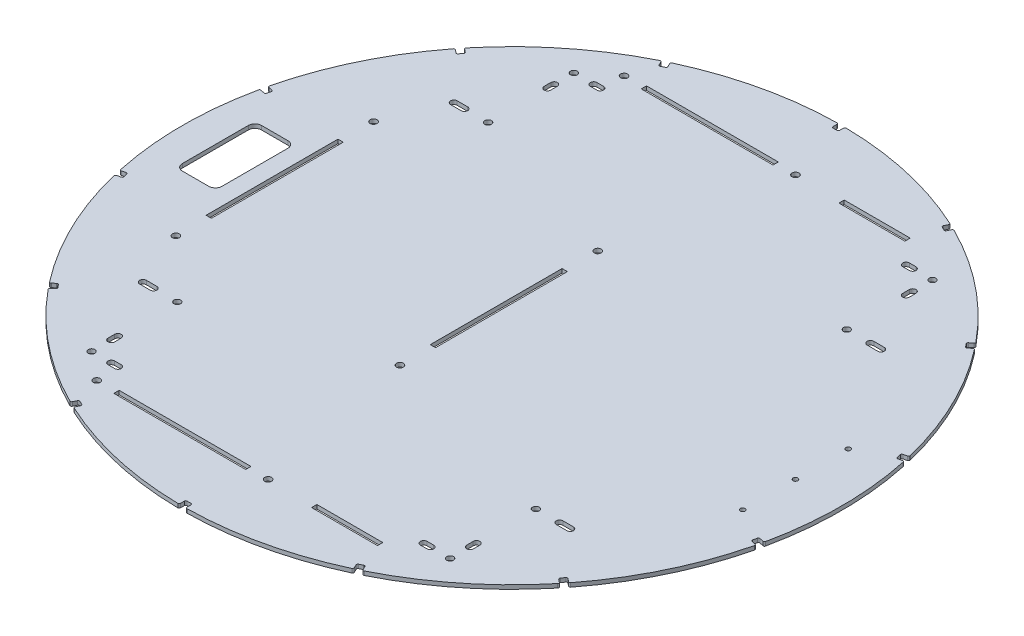
from build123d import *

# Parameters (mm, degrees)
SKETCH1_R                = 250
BOSS_EXTRUDE1_DEPTH      = 3
CUT_EXTRUDE5_DEPTH       = 4
FILLET1_R                = 1
CIRPATTERN1_COUNT        = 14
FILLET1_OF_CIRPATTERN1_R = 1
SKETCH17_W               = 4
SKETCH17_H               = 100
CUT_EXTRUDE11_DEPTH      = 10
SKETCH18_R               = 2.6
CUT_EXTRUDE12_DEPTH      = 10
CUT_EXTRUDE14_DEPTH      = 14
SKETCH21_R               = 2.6
SKETCH21_W               = 100
SKETCH21_H               = 4
CUT_EXTRUDE15_DEPTH      = 14
SKETCH22_R               = 2.5
CUT_EXTRUDE16_DEPTH      = 14
CUT_EXTRUDE17_DEPTH      = 14
SKETCH25_W               = 50
SKETCH25_H               = 4
CUT_EXTRUDE18_DEPTH      = 4
CUT_EXTRUDE19_DEPTH      = 4
SKETCH27_R               = 1.8
CUT_EXTRUDE20_DEPTH      = 10


with BuildPart() as part:
    # Sketch1 → Boss-Extrude1 (new body)
    with BuildSketch(Plane(origin=(0, 0, 0), x_dir=(1, 0, 0), z_dir=(0, 1, 0))):
        Circle(SKETCH1_R)
    extrude(amount=BOSS_EXTRUDE1_DEPTH)

    # Sketch11 → Cut-Extrude5 (cut)
    with BuildSketch(Plane(origin=(0, 3, 0), x_dir=(1, 0, 0), z_dir=(0, 1, 0))):
        with BuildLine():
            Line((1.5, 245), (-1.5, 245))
            ThreePointArc((-1.5, 245), (-2.207106781, 245.292893219), (-2.5, 246))
            Line((-2.5, 246), (-2.5, 255))
            Line((-2.5, 255), (2.5, 255))
            Line((2.5, 255), (2.5, 246))
            ThreePointArc((2.5, 246), (2.207106781, 245.292893219), (1.5, 245))
        make_face()
    cut_extrude5 = extrude(amount=-CUT_EXTRUDE5_DEPTH, mode=Mode.SUBTRACT)

    # Fillet1
    fillet1_edges = [part.edges().sort_by_distance(p)[0] for p in [
        (2.5, 1.5, -249.987499687),
        (-2.5, 1.5, -249.987499687),
    ]]
    fillet(fillet1_edges, radius=FILLET1_R)

    # CirPattern1: Cut-Extrude5 ×14 about axis
    cirpattern1_axis = Axis((0, 3, 0), (0, -1, 0))
    for i in range(1, CIRPATTERN1_COUNT):
        add(cut_extrude5.rotate(cirpattern1_axis, i * 360 / CIRPATTERN1_COUNT), mode=Mode.SUBTRACT)

    # Fillet1 of CirPattern1
    fillet1_of_cirpattern1_edges = [part.edges().sort_by_distance(p)[0] for p in [
        (110.717933267, 1.5, -224.146245235),
        (106.213088927, 1.5, -226.315663931),
        (197.006821984, 1.5, -153.910077941),
        (193.889372974, 1.5, -157.819235353),
        (244.276093477, 1.5, -53.190132127),
        (243.163488807, 1.5, -58.064771688),
        (243.163488807, 1.5, 58.064771688),
        (244.276093477, 1.5, 53.190132127),
        (193.889372974, 1.5, 157.819235353),
        (197.006821984, 1.5, 153.910077941),
        (106.213088927, 1.5, 226.315663931),
        (110.717933267, 1.5, 224.146245235),
        (-2.5, 1.5, 249.987499687),
        (2.5, 1.5, 249.987499687),
        (-110.717933267, 1.5, 224.146245235),
        (-106.213088927, 1.5, 226.315663931),
        (-197.006821984, 1.5, 153.910077941),
        (-193.889372974, 1.5, 157.819235353),
        (-244.276093477, 1.5, 53.190132127),
        (-243.163488807, 1.5, 58.064771688),
        (-243.163488807, 1.5, -58.064771688),
        (-244.276093477, 1.5, -53.190132127),
        (-193.889372974, 1.5, -157.819235353),
        (-197.006821984, 1.5, -153.910077941),
        (-106.213088927, 1.5, -226.315663931),
        (-110.717933267, 1.5, -224.146245235),
    ]]
    fillet(fillet1_of_cirpattern1_edges, radius=FILLET1_OF_CIRPATTERN1_R)

    # Sketch17 → Cut-Extrude11 (cut)
    with BuildSketch(Plane(origin=(0, 3, 0), x_dir=(1, 0, 0), z_dir=(0, 1, 0))):
        with Locations((-10, 0)):
            Rectangle(SKETCH17_W, SKETCH17_H)
        with Locations((-180, 0)):
            Rectangle(SKETCH17_W, SKETCH17_H)
    extrude(amount=-CUT_EXTRUDE11_DEPTH, mode=Mode.SUBTRACT)

    # Sketch18 → Cut-Extrude12 (cut)
    with BuildSketch(Plane(origin=(0, 3, 0), x_dir=(1, 0, 0), z_dir=(0, 1, 0))):
        with Locations((-180, 75)):
            Circle(SKETCH18_R)
        with Locations((-180, -75)):
            Circle(SKETCH18_R)
        with Locations((-10, 75)):
            Circle(SKETCH18_R)
        with Locations((-10, -75)):
            Circle(SKETCH18_R)
    extrude(amount=-CUT_EXTRUDE12_DEPTH, mode=Mode.SUBTRACT)

    # Sketch20 → Cut-Extrude14 (cut)
    with BuildSketch(Plane.XZ):
        with BuildLine():
            Line((-162, -115.4), (-154, -115.4))
            ThreePointArc((-154, -115.4), (-151.5, -117.9), (-154, -120.4))
            Line((-154, -120.4), (-162, -120.4))
            ThreePointArc((-162, -120.4), (-164.5, -117.9), (-162, -115.4))
        make_face()
        with BuildLine():
            Line((162, -115.4), (154, -115.4))
            ThreePointArc((154, -115.4), (151.5, -117.9), (154, -120.4))
            Line((154, -120.4), (162, -120.4))
            ThreePointArc((162, -120.4), (164.5, -117.9), (162, -115.4))
        make_face()
        with BuildLine():
            Line((162, 115.4), (154, 115.4))
            ThreePointArc((154, 115.4), (151.5, 117.9), (154, 120.4))
            Line((154, 120.4), (162, 120.4))
            ThreePointArc((162, 120.4), (164.5, 117.9), (162, 115.4))
        make_face()
        with BuildLine():
            Line((-162, 115.4), (-154, 115.4))
            ThreePointArc((-154, 115.4), (-151.5, 117.9), (-154, 120.4))
            Line((-154, 120.4), (-162, 120.4))
            ThreePointArc((-162, 120.4), (-164.5, 117.9), (-162, 115.4))
        make_face()
    extrude(amount=-CUT_EXTRUDE14_DEPTH, mode=Mode.SUBTRACT)

    # Sketch21 → Cut-Extrude15 (cut)
    with BuildSketch(Plane(origin=(0, 3, 0), x_dir=(1, 0, 0), z_dir=(0, 1, 0))):
        with Locations((-115, 200)):
            Circle(SKETCH21_R)
        with Locations((15, 200)):
            Circle(SKETCH21_R)
        with Locations((15, -200)):
            Circle(SKETCH21_R)
        with Locations((-115, -200)):
            Circle(SKETCH21_R)
        with Locations((-50, 200)):
            Rectangle(SKETCH21_W, SKETCH21_H)
        with Locations((-50, -200)):
            Rectangle(SKETCH21_W, SKETCH21_H)
    extrude(amount=-CUT_EXTRUDE15_DEPTH, mode=Mode.SUBTRACT)

    # Sketch22 → Cut-Extrude16 (cut)
    with BuildSketch(Plane(origin=(0, 3, 0), x_dir=(1, 0, 0), z_dir=(0, 1, 0))):
        with Locations((-136, -117.9)):
            Circle(SKETCH22_R)
        with Locations((-136, 117.9)):
            Circle(SKETCH22_R)
        with Locations((136, 117.9)):
            Circle(SKETCH22_R)
        with Locations((136, -117.9)):
            Circle(SKETCH22_R)
        with Locations((-136, 182.9)):
            Circle(SKETCH22_R)
        with Locations((136, 182.9)):
            Circle(SKETCH22_R)
        with Locations((-136, -182.9)):
            Circle(SKETCH22_R)
        with Locations((136, -182.9)):
            Circle(SKETCH22_R)
    extrude(amount=-CUT_EXTRUDE16_DEPTH, mode=Mode.SUBTRACT)

    # Sketch24 → Cut-Extrude17 (cut)
    with BuildSketch(Plane.XZ):
        with BuildLine():
            Line((-200, -30), (-220, -30))
            ThreePointArc((-220, -30), (-223.535533906, -28.535533906), (-225, -25))
            Line((-225, -25), (-225, 25))
            ThreePointArc((-225, 25), (-223.535533906, 28.535533906), (-220, 30))
            Line((-220, 30), (-200, 30))
            ThreePointArc((-200, 30), (-196.464466094, 28.535533906), (-195, 25))
            Line((-195, 25), (-195, -25))
            ThreePointArc((-195, -25), (-196.464466094, -28.535533906), (-200, -30))
        make_face()
    extrude(amount=-CUT_EXTRUDE17_DEPTH, mode=Mode.SUBTRACT)

    # Sketch25 → Cut-Extrude18 (cut)
    with BuildSketch(Plane(origin=(0, 3, 0), x_dir=(1, 0, 0), z_dir=(0, 1, 0))):
        with Locations((75, 200)):
            Rectangle(SKETCH25_W, SKETCH25_H)
        with Locations((75, -200)):
            Rectangle(SKETCH25_W, SKETCH25_H)
    extrude(amount=-CUT_EXTRUDE18_DEPTH, mode=Mode.SUBTRACT)

    # Sketch26 → Cut-Extrude19 (cut)
    with BuildSketch(Plane(origin=(0, 3, 0), x_dir=(1, 0, 0), z_dir=(0, 1, 0))):
        with BuildLine():
            Line((-138.5, 162.9), (-138.5, 167.9))
            ThreePointArc((-138.5, 167.9), (-136, 170.4), (-133.5, 167.9))
            Line((-133.5, 167.9), (-133.5, 162.9))
            ThreePointArc((-133.5, 162.9), (-136, 160.4), (-138.5, 162.9))
        make_face()
        with BuildLine():
            Line((-116, 180.4), (-121, 180.4))
            ThreePointArc((-121, 180.4), (-123.5, 182.9), (-121, 185.4))
            Line((-121, 185.4), (-116, 185.4))
            ThreePointArc((-116, 185.4), (-113.5, 182.9), (-116, 180.4))
        make_face()
        with BuildLine():
            Line((116, 180.4), (121, 180.4))
            ThreePointArc((121, 180.4), (123.5, 182.9), (121, 185.4))
            Line((121, 185.4), (116, 185.4))
            ThreePointArc((116, 185.4), (113.5, 182.9), (116, 180.4))
        make_face()
        with BuildLine():
            Line((138.5, 162.9), (138.5, 167.9))
            ThreePointArc((138.5, 167.9), (136, 170.4), (133.5, 167.9))
            Line((133.5, 167.9), (133.5, 162.9))
            ThreePointArc((133.5, 162.9), (136, 160.4), (138.5, 162.9))
        make_face()
        with BuildLine():
            Line((116, -180.4), (121, -180.4))
            ThreePointArc((121, -180.4), (123.5, -182.9), (121, -185.4))
            Line((121, -185.4), (116, -185.4))
            ThreePointArc((116, -185.4), (113.5, -182.9), (116, -180.4))
        make_face()
        with BuildLine():
            Line((138.5, -162.9), (138.5, -167.9))
            ThreePointArc((138.5, -167.9), (136, -170.4), (133.5, -167.9))
            Line((133.5, -167.9), (133.5, -162.9))
            ThreePointArc((133.5, -162.9), (136, -160.4), (138.5, -162.9))
        make_face()
        with BuildLine():
            Line((-138.5, -162.9), (-138.5, -167.9))
            ThreePointArc((-138.5, -167.9), (-136, -170.4), (-133.5, -167.9))
            Line((-133.5, -167.9), (-133.5, -162.9))
            ThreePointArc((-133.5, -162.9), (-136, -160.4), (-138.5, -162.9))
        make_face()
        with BuildLine():
            Line((-116, -180.4), (-121, -180.4))
            ThreePointArc((-121, -180.4), (-123.5, -182.9), (-121, -185.4))
            Line((-121, -185.4), (-116, -185.4))
            ThreePointArc((-116, -185.4), (-113.5, -182.9), (-116, -180.4))
        make_face()
    extrude(amount=-CUT_EXTRUDE19_DEPTH, mode=Mode.SUBTRACT)

    # Sketch27 → Cut-Extrude20 (cut)
    with BuildSketch(Plane(origin=(0, 3, 0), x_dir=(1, 0, 0), z_dir=(0, 1, 0))):
        with Locations((215, 0)):
            Circle(SKETCH27_R)
        with Locations((215, 40)):
            Circle(SKETCH27_R)
        with Locations((215, -40)):
            Circle(SKETCH27_R)
    extrude(amount=-CUT_EXTRUDE20_DEPTH, mode=Mode.SUBTRACT)


solid = part.part
